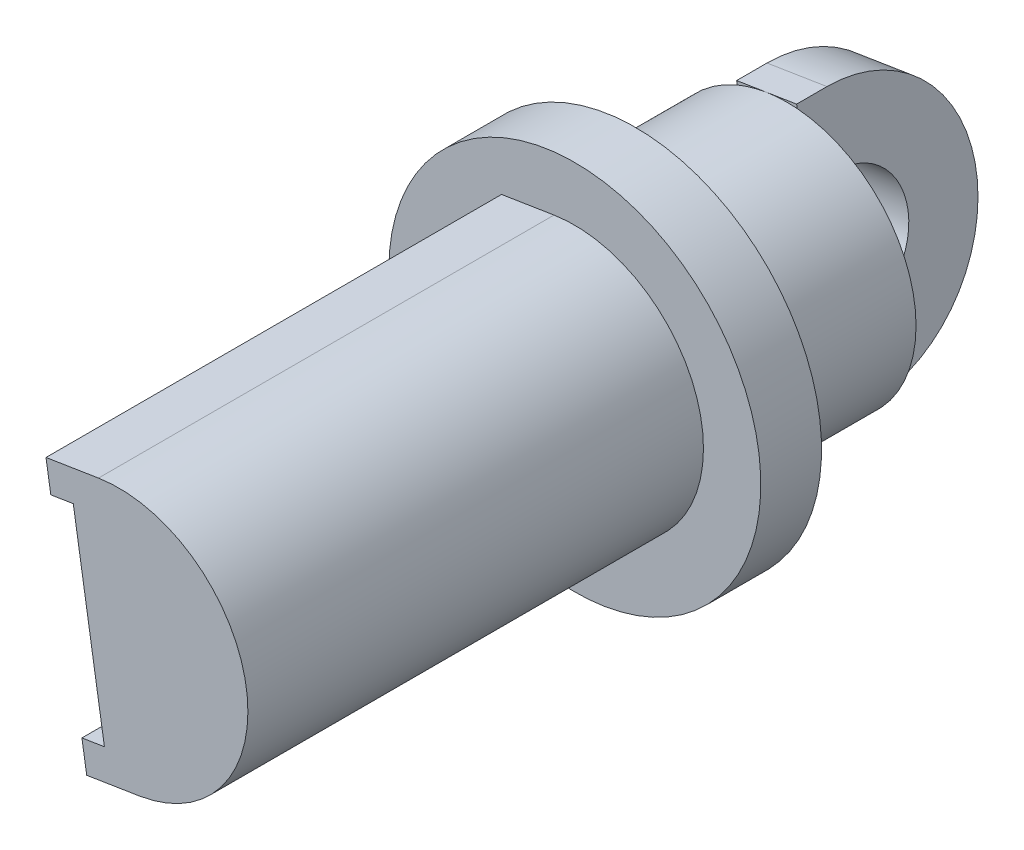
from build123d import *

# Parameters (mm, degrees)
SALIENTE_EXTRUIR1_DEPTH           = 2
DI_METRO_DE_TALADRO_4_0_4_1_D     = 4
DI_METRO_DE_TALADRO_4_0_4_1_DEPTH = 3.323811401
CROQUIS4_R                        = 4.25
SALIENTE_EXTRUIR2_DEPTH           = 7
SALIENTE_EXTRUIR3_DEPTH           = 15
CORTAR_EXTRUIR1_DEPTH             = 15
CROQUIS7_R                        = 6.125
SALIENTE_EXTRUIR4_DEPTH           = 2


with BuildPart() as part:
    # Croquis1 → Saliente-Extruir1 (new body)
    with BuildSketch(Plane(origin=(-45.591866133, -7.28172098, 0), x_dir=(0.15771642640636402, -0.9874844448605792, 0), z_dir=(-0.9874844448605792, -0.15771642640636402, 0))):
        with BuildLine():
            Line((51.04106459, 0), (42.54106459, 0))
            Line((42.54106459, 0), (42.54106459, -1))
            ThreePointArc((42.54106459, -1), (46.79106459, -5.25), (51.04106459, -1))
            Line((51.04106459, -1), (51.04106459, 0))
        make_face()
    extrude(amount=-SALIENTE_EXTRUIR1_DEPTH)

    # Diámetro de taladro Ø4.0 (4)1
    with Locations(Plane(origin=(-43.616897243, -6.966288127, 0), x_dir=(0, 0, -1), z_dir=(0.9874844448605791, 0.15771642640636402, 0))):
        with Locations((1, -46.79106459)):
            Hole(DI_METRO_DE_TALADRO_4_0_4_1_D / 2, depth=DI_METRO_DE_TALADRO_4_0_4_1_DEPTH)

    # Croquis4 → Saliente-Extruir2 (add)
    with BuildSketch(Plane(origin=(0, 0, 0), x_dir=(-1, 0, 0), z_dir=(0, 0, -1))):
        with Locations(Location((37.224662193, -53.329452995, 0), (0, 0, 67.316665151))):
            Circle(CROQUIS4_R)
    extrude(amount=-SALIENTE_EXTRUIR2_DEPTH)

    # Croquis5 → Saliente-Extruir3 (add)
    with BuildSketch(Plane.XY.offset(7)):
        with BuildLine():
            Line((-39.623054784, -49.408647851), (-37.894957006, -49.132644104))
            ThreePointArc((-37.894957006, -49.132644104), (-33.027853303, -52.659158183), (-36.554367381, -57.526261886))
            Line((-36.554367381, -57.526261886), (-38.28246516, -57.802265632))
            Line((-38.28246516, -57.802265632), (-39.623054784, -49.408647851))
        make_face()
    extrude(amount=SALIENTE_EXTRUIR3_DEPTH)

    # Croquis6 → Cortar-Extruir1 (cut)
    with BuildSketch(Plane.XY.offset(22)):
        Polygon((-38.724725024, -50.277844976), (-39.712209469, -50.435561402), (-38.687052697, -56.854210294), (-37.699568252, -56.696493867), align=None)
    extrude(amount=-CORTAR_EXTRUIR1_DEPTH, mode=Mode.SUBTRACT)

    # Croquis7 → Saliente-Extruir4 (add)
    with BuildSketch(Plane(origin=(0, 0, 7), x_dir=(-1, 0, 0), z_dir=(0, 0, -1))):
        with Locations((37.21095217, -53.415293358)):
            Circle(CROQUIS7_R)
    extrude(amount=SALIENTE_EXTRUIR4_DEPTH)


solid = part.part
